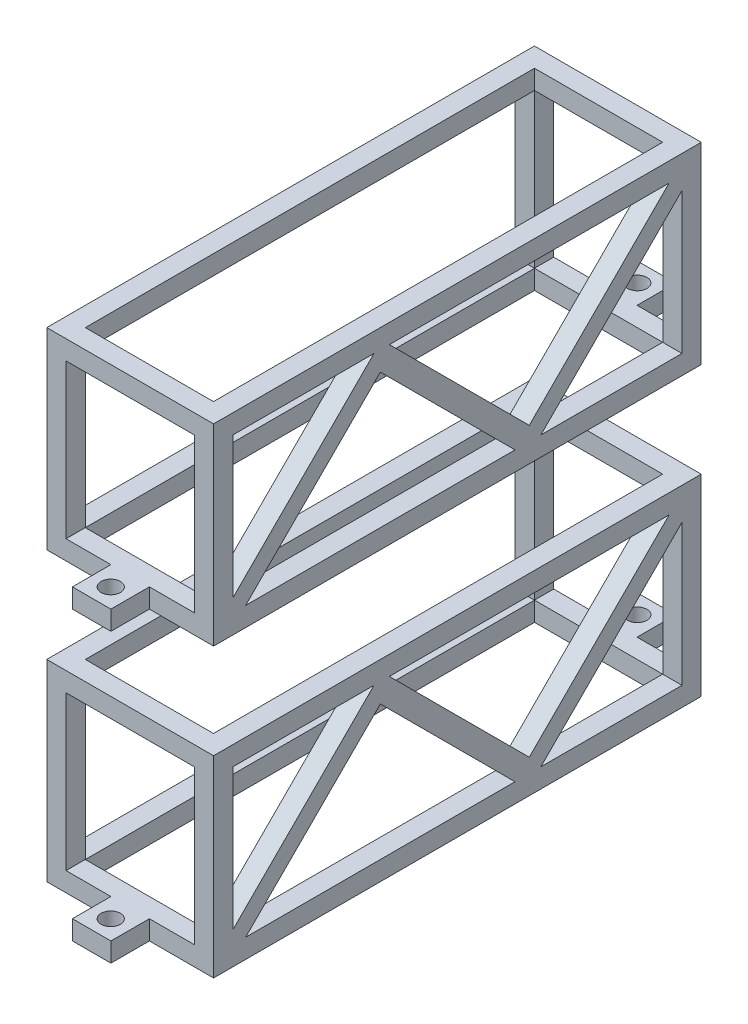
from build123d import *

# Parameters (mm, degrees)
SKETCH1_W               = 25.995225734
SKETCH1_H               = 76.001633454
SKETCH1_W_2             = 19.976175266
SKETCH1_H_2             = 70.006806604
BOSS_EXTRUDE2_DEPTH     = 30
CUT_EXTRUDE1_DEPTH      = 87.764304764
CUT_EXTRUDE1_DEPTH_BACK = 87.764304764
SKETCH2_W               = 20
SKETCH2_H               = 24
CUT_EXTRUDE2_DEPTH      = 65.240916967
CUT_EXTRUDE2_DEPTH_BACK = 65.240916967
SKETCH3_W               = 70
SKETCH3_H               = 24
SKETCH5_W               = 6
SKETCH5_H               = 6
SKETCH5_R               = 1.5
BOSS_EXTRUDE3_DEPTH     = 3
BOSS_EXTRUDE7_DEPTH     = 3


with BuildPart() as part:
    # Sketch1 → Boss-Extrude2 (new body)
    with BuildSketch(Plane(origin=(0, 0, 0), x_dir=(1, 0, 0), z_dir=(0, 1, 0))):
        with Locations((-16.187936527, 12.508030535)):
            Rectangle(SKETCH1_W, SKETCH1_H)
        with Locations((-16.187936527, 12.508030535)):
            Rectangle(SKETCH1_W_2, SKETCH1_H_2, mode=Mode.SUBTRACT)
    extrude(amount=BOSS_EXTRUDE2_DEPTH)

    # Sketch2 → Cut-Extrude1 (cut, two sides: drawn at the far end of the back side and taken through both)
    with BuildSketch(Plane.XY.offset(25.492786192).offset(-CUT_EXTRUDE1_DEPTH_BACK)):
        with Locations((-16.185549394, 15)):
            Rectangle(SKETCH2_W, SKETCH2_H)
    extrude(amount=CUT_EXTRUDE1_DEPTH + CUT_EXTRUDE1_DEPTH_BACK, mode=Mode.SUBTRACT)

    # Sketch3 → Cut-Extrude2 (cut, two sides: drawn at the far end of the back side and taken through both)
    with BuildSketch(Plane.ZY.offset(29.185549394).offset(-CUT_EXTRUDE2_DEPTH_BACK)):
        with Locations((-12.507213808, 15)):
            Rectangle(SKETCH3_W, SKETCH3_H)
    extrude(amount=CUT_EXTRUDE2_DEPTH + CUT_EXTRUDE2_DEPTH_BACK, mode=Mode.SUBTRACT)

    # Sketch5 → Boss-Extrude3 (add)
    # profile 1 of 2: a face of its own
    with BuildSketch(Plane(origin=(0, 0, 0), x_dir=(-1, 0, 0), z_dir=(0, -1, 0))):
        with Locations((16.19032366, -28.492786192)):
            Rectangle(SKETCH5_W, SKETCH5_H)
        with Locations(Location((16.19032366, -28.516675752, 0), (0, 0, 90))):
            Circle(SKETCH5_R, mode=Mode.SUBTRACT)
    # profile 2 of 2: a face of its own
    with BuildSketch(Plane(origin=(0, 0, 0), x_dir=(-1, 0, 0), z_dir=(0, -1, 0))):
        with Locations((16.19032366, 53.508847262)):
            Rectangle(SKETCH5_W, SKETCH5_H)
        with Locations(Location((16.19032366, 53.542876945, 0), (0, 0, 90))):
            Circle(SKETCH5_R, mode=Mode.SUBTRACT)
    extrude(amount=-BOSS_EXTRUDE3_DEPTH)

    # Sketch7 → Boss-Extrude7 (add)
    with BuildSketch(Plane(origin=(-3.19032366, 0, 0), x_dir=(0, 0, -1), z_dir=(1, 0, 0))):
        Polygon((47.507213808, 25), (23.497630028, 0.990416221), (0.497630028, 23.990416221), (-20.492786192, 3), (-22.492786192, 3), (-22.492786192, 5), (-0.492786192, 27), (1.507213808, 27), (1.90718013, 27), (23.707196969, 5.199983161), (45.507213808, 27), (47.507213808, 27), align=None)
    extrude(amount=-BOSS_EXTRUDE7_DEPTH)


with BuildPart() as body_2:
    # Body-Move/Copy2: copy of part
    add(part.part.moved(Location((0, 44.788783679, 0))))


solid = Compound([part.part, body_2.part])
